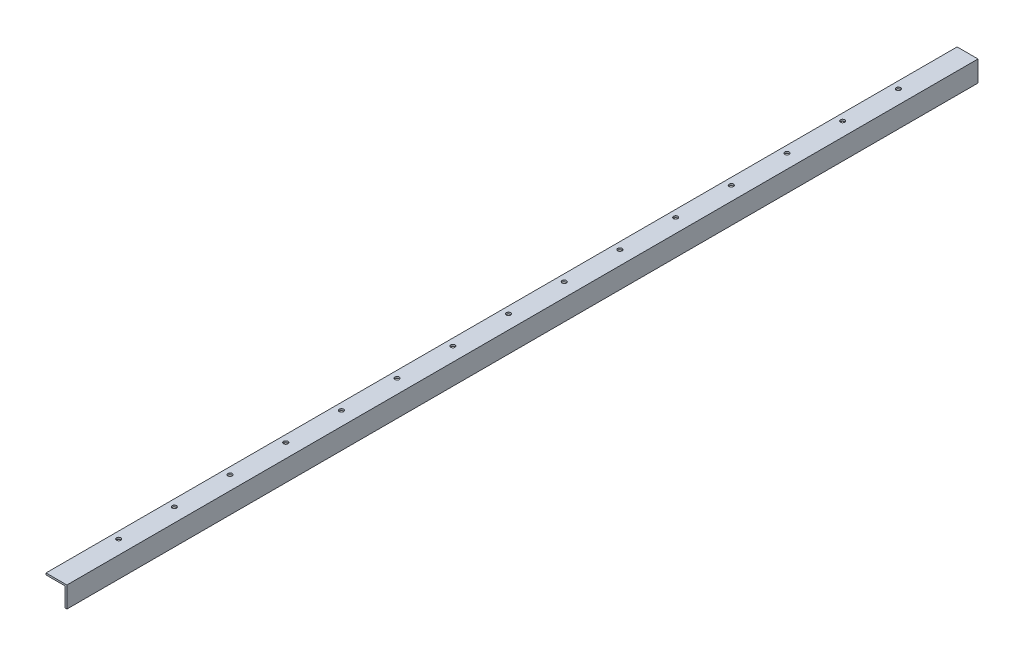
from build123d import *

# Parameters (mm, degrees)
BOSS_EXTRUDE1_DEPTH = 1662.1125
SKETCH4_R           = 3.96875
CUT_EXTRUDE3_DEPTH  = 44.45
LPATTERN1_COUNT     = 15
LPATTERN1_PITCH     = 101.6


with BuildPart() as part:
    # Sketch1 → Boss-Extrude1 (new body)
    with BuildSketch(Plane.XY):
        Polygon((0, 0), (-38.1, 0), (-38.1, -3.175), (-3.175, -3.175), (-3.175, -38.1), (0, -38.1), align=None)
    extrude(amount=BOSS_EXTRUDE1_DEPTH)

    # Sketch4 → Cut-Extrude3 (cut)
    with BuildSketch(Plane(origin=(10.670100368, 3.175, 817.757022881), x_dir=(1, 0, 0), z_dir=(0, 1, 0))):
        with Locations(Location((-36.070100368, 697.900772881, 0), (0, 0, 270))):
            Circle(SKETCH4_R)
    cut_extrude3 = extrude(amount=-CUT_EXTRUDE3_DEPTH, mode=Mode.SUBTRACT)

    # LPattern1: Cut-Extrude3 ×15
    with Locations(*[(0, 0, i * LPATTERN1_PITCH) for i in range(1, LPATTERN1_COUNT)]):
        add(cut_extrude3, mode=Mode.SUBTRACT)


solid = part.part
